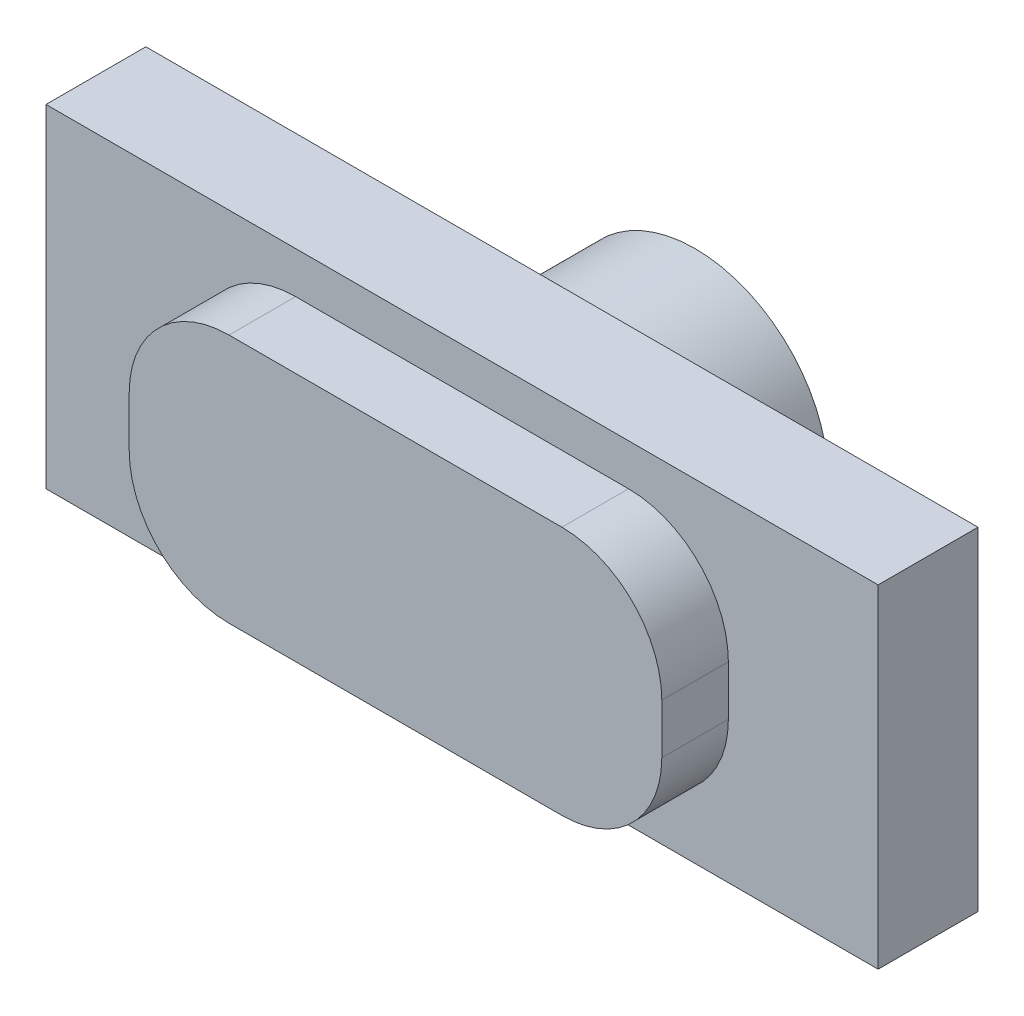
from build123d import *

# Parameters (mm, degrees)
SKICA1_W                 = 25
SKICA1_H                 = 10
P_IDAT_VYSUNUT_M1_DEPTH  = 3
P_IDAT_VYSUNUT_M2_DEPTH  = 2
P_IDAT_VYSUNUT_M3_DEPTH  = 4
SKICA4_R                 = 2.6
ODEBRAT_VYSUNUT_M1_DEPTH = 8.7


with BuildPart() as part:
    # Skica1 → Přidat vysunutím1 (new body)
    with BuildSketch(Plane.XY):
        Rectangle(SKICA1_W, SKICA1_H)
    extrude(amount=P_IDAT_VYSUNUT_M1_DEPTH)

    # Skica2 → Přidat vysunutím2 (add)
    with BuildSketch(Plane.XY.offset(3)):
        with BuildLine():
            Line((-5, 3.75), (5, 3.75))
            ThreePointArc((5, 3.75), (7.121320344, 2.871320344), (8, 0.75))
            Line((8, 0.75), (8, -0.75))
            ThreePointArc((8, -0.75), (7.121320344, -2.871320344), (5, -3.75))
            Line((5, -3.75), (-5, -3.75))
            ThreePointArc((-5, -3.75), (-7.121320344, -2.871320344), (-8, -0.75))
            Line((-8, -0.75), (-8, 0.75))
            ThreePointArc((-8, 0.75), (-7.121320344, 2.871320344), (-5, 3.75))
        make_face()
    extrude(amount=P_IDAT_VYSUNUT_M2_DEPTH)

    # Skica3 → Přidat vysunutím3 (add)
    with BuildSketch(Plane(origin=(0, 0, 0), x_dir=(-1, 0, 0), z_dir=(0, 0, -1))):
        with BuildLine():
            ThreePointArc((3.968626967, 0.5), (0, 4), (-3.968626967, 0.5))
            Line((-3.968626967, 0.5), (3.968626967, 0.5))
        make_face()
        with BuildLine():
            ThreePointArc((-3.968626967, -0.5), (0, -4), (3.968626967, -0.5))
            Line((3.968626967, -0.5), (-3.968626967, -0.5))
        make_face()
    extrude(amount=P_IDAT_VYSUNUT_M3_DEPTH)

    # Skica4 → Odebrat vysunutím1 (cut)
    with BuildSketch(Plane(origin=(0, 0, -4), x_dir=(-1, 0, 0), z_dir=(0, 0, -1))):
        Circle(SKICA4_R)
    extrude(amount=-ODEBRAT_VYSUNUT_M1_DEPTH, mode=Mode.SUBTRACT)


solid = part.part
